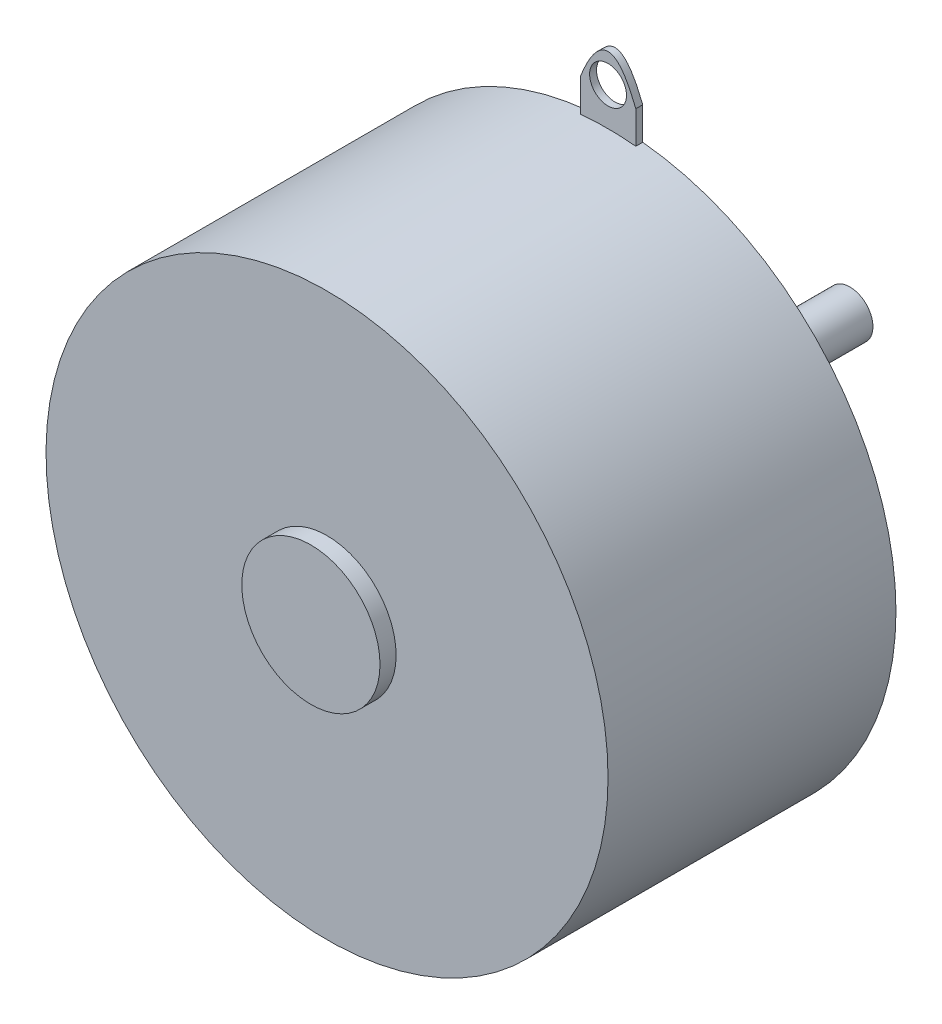
from build123d import *

# Parameters (mm, degrees)
SKETCH_1_R               = 12.2
EXTRUDE_1_DEPTH          = 12.5
SKETCH_2_R               = 3
EXTRUDE_2_DEPTH          = 0.7
SKETCH_3_R               = 3.25
EXTRUDE_3_DEPTH          = 1
SKETCH_4_R               = 1
EXTRUDE_4_DEPTH          = 9.2
SKETCH_5_R               = 0.85
CUT_EXTRUDE_1_DEPTH      = 0.35
SKETCH_9_R               = 0.8
EXTRUDE_7_DEPTH          = 0.3
CUT_EXTRUDE_START        = -0.5
SKETCH_10_R              = 3.25
SKETCH_10_R_2            = 1
CUT_EXTRUDE_3_DEPTH      = 0.5
CUT_EXTRUDE_4_DEPTH      = 2
CUT_EXTRUDE_4_DEPTH_BACK = 0.2
SKETCH_11_R              = 0.3


with BuildPart() as part:
    # 草图1 → 凸台-拉伸1 (new body)
    with BuildSketch(Plane.XY):
        Circle(SKETCH_1_R)
    extrude(amount=EXTRUDE_1_DEPTH)

    # 草图2 → 凸台-拉伸2 (add)
    with BuildSketch(Plane.XY.offset(12.5)):
        Circle(SKETCH_2_R)
    extrude(amount=EXTRUDE_2_DEPTH)

    # 草图3 → 凸台-拉伸3 (add)
    with BuildSketch(Plane(origin=(0, 0, 0), x_dir=(-1, 0, 0), z_dir=(0, 0, -1))):
        Circle(SKETCH_3_R)
    extrude(amount=EXTRUDE_3_DEPTH)

    # 草图4 → 凸台-拉伸4 (add)
    with BuildSketch(Plane(origin=(0, 0, -1), x_dir=(-1, 0, 0), z_dir=(0, 0, -1))):
        Circle(SKETCH_4_R)
    extrude(amount=EXTRUDE_4_DEPTH)

    # 草图5 → 切除-拉伸1 (cut)
    with BuildSketch(Plane(origin=(0, 0, 0), x_dir=(-1, 0, 0), z_dir=(0, 0, -1))):
        with Locations((0, 8.25)):
            Circle(SKETCH_5_R)
        with Locations((7.144709581, 4.125)):
            Circle(SKETCH_5_R)
        with Locations((7.144709581, -4.125)):
            Circle(SKETCH_5_R)
        with Locations((0, -8.25)):
            Circle(SKETCH_5_R)
        with Locations((-7.144709581, -4.125)):
            Circle(SKETCH_5_R)
        with Locations((-7.144709581, 4.125)):
            Circle(SKETCH_5_R)
    extrude(amount=-CUT_EXTRUDE_1_DEPTH, mode=Mode.SUBTRACT)

    # 草图9 → 凸台-拉伸7 (add)
    # profile 1 of 2: a face of its own
    with BuildSketch(Plane(origin=(0, 0, 0), x_dir=(-1, 0, 0), z_dir=(0, 0, -1))):
        with BuildLine():
            Line((-1.205654287, 13.55027997), (-1.205654287, 12.14027997))
            add(Edge.make_bspline(
                [(-1.205654287, 12.14027997), (0, 12.25972003), (1.205654287, 12.14027997)],
                knots=[0, 0, 0, 1, 1, 1], degree=2))
            Line((1.205654287, 12.14027997), (1.205654287, 13.55027997))
            add(Edge.make_bspline(
                [(-1.205654287, 13.55027997), (0, 16.646945855), (1.205654287, 13.55027997)],
                knots=[0, 0, 0, 1, 1, 1], degree=2))
        make_face()
        with Locations((0, 13.85)):
            Circle(SKETCH_9_R, mode=Mode.SUBTRACT)
    # profile 2 of 2: a face of its own
    with BuildSketch(Plane(origin=(0, 0, 0), x_dir=(-1, 0, 0), z_dir=(0, 0, -1))):
        with BuildLine():
            Line((1.205654287, -13.55027997), (1.205654287, -12.14027997))
            add(Edge.make_bspline(
                [(-1.205654287, -12.14027997), (0, -12.25972003), (1.205654287, -12.14027997)],
                knots=[0, 0, 0, 1, 1, 1], degree=2))
            Line((-1.205654287, -12.14027997), (-1.205654287, -13.55027997))
            add(Edge.make_bspline(
                [(-1.205654287, -13.55027997), (0, -16.646945855), (1.205654287, -13.55027997)],
                knots=[0, 0, 0, 1, 1, 1], degree=2))
        make_face()
        with Locations((0, -13.85)):
            Circle(SKETCH_9_R, mode=Mode.SUBTRACT)
    extrude(amount=-EXTRUDE_7_DEPTH)

    # 草图10 → 切除-拉伸3 (cut)
    with BuildSketch(Plane(origin=(0, 0, -1), x_dir=(-1, 0, 0), z_dir=(0, 0, -1)).offset(CUT_EXTRUDE_START)):
        Circle(SKETCH_10_R)
        Circle(SKETCH_10_R_2, mode=Mode.SUBTRACT)
    extrude(amount=CUT_EXTRUDE_3_DEPTH, mode=Mode.SUBTRACT)

    # 草图11 → 切除-拉伸4 (cut, two sides: drawn at the far end of the back side and taken through both)
    with BuildSketch(Plane(origin=(-21.214961085, -62.254689725, -57.176272609), x_dir=(0, 0, 1), z_dir=(0.9558895782864368, -0.2937262571228151, 2.460292199088584e-14)).offset(-CUT_EXTRUDE_4_DEPTH_BACK)):
        with Locations(Location((49.842566165, -65.698034164, 0), (0, 0, 90))):
            Circle(SKETCH_11_R)
    extrude(amount=CUT_EXTRUDE_4_DEPTH + CUT_EXTRUDE_4_DEPTH_BACK, mode=Mode.SUBTRACT)


solid = part.part
